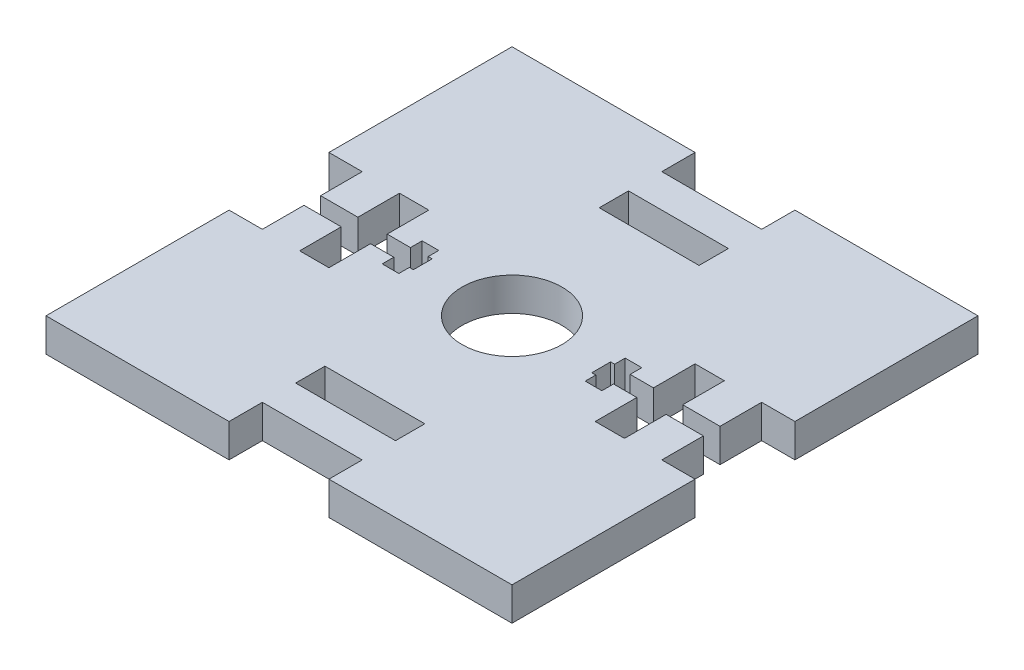
from build123d import *

# Parameters (mm, degrees)
SKETCH1_W           = 88.9
SKETCH1_H           = 88.9
BOSS_EXTRUDE1_DEPTH = 6.35
SKETCH2_R           = 9.525
SKETCH2_W           = 19.05
SKETCH2_H           = 5.588
SKETCH2_W_2         = 5.588
SKETCH2_H_2         = 19.05
CUT_EXTRUDE1_DEPTH  = 126.88384527
SKETCH3_W           = 19.05
SKETCH3_H           = 6.35
SKETCH3_W_2         = 6.35
SKETCH3_H_2         = 19.05
CUT_EXTRUDE2_DEPTH  = 126.88384527
CUT_EXTRUDE3_DEPTH  = 126.88384527


with BuildPart() as part:
    # Sketch1 → Boss-Extrude1 (new body)
    with BuildSketch(Plane(origin=(0, 0, 0), x_dir=(1, 0, 0), z_dir=(0, 1, 0))):
        with Locations((44.45, 44.45)):
            Rectangle(SKETCH1_W, SKETCH1_H)
    extrude(amount=BOSS_EXTRUDE1_DEPTH)

    # Sketch2 → Cut-Extrude1 (cut, through all)
    with BuildSketch(Plane(origin=(0, 6.35, 0), x_dir=(1, 0, 0), z_dir=(0, 1, 0))):
        with Locations(Location((44.45, 44.45, 0), (0, 0, 270))):
            Circle(SKETCH2_R)
        with Locations((44.45, 73.406)):
            Rectangle(SKETCH2_W, SKETCH2_H)
        with Locations((16.256, 44.45)):
            Rectangle(SKETCH2_W_2, SKETCH2_H_2)
        with Locations((72.644, 44.45)):
            Rectangle(SKETCH2_W_2, SKETCH2_H_2)
        with Locations((44.45, 15.494)):
            Rectangle(SKETCH2_W, SKETCH2_H)
    extrude(amount=-CUT_EXTRUDE1_DEPTH, mode=Mode.SUBTRACT)

    # Sketch3 → Cut-Extrude2 (cut, through all)
    with BuildSketch(Plane(origin=(0, 6.35, 0), x_dir=(1, 0, 0), z_dir=(0, 1, 0))):
        with Locations((44.45, 85.725)):
            Rectangle(SKETCH3_W, SKETCH3_H)
        with Locations((85.725, 44.45)):
            Rectangle(SKETCH3_W_2, SKETCH3_H_2)
        with Locations((44.45, 3.175)):
            Rectangle(SKETCH3_W, SKETCH3_H)
        with Locations((3.175, 44.45)):
            Rectangle(SKETCH3_W_2, SKETCH3_H_2)
    extrude(amount=-CUT_EXTRUDE2_DEPTH, mode=Mode.SUBTRACT)

    # Sketch4 → Cut-Extrude3 (cut, through all)
    with BuildSketch(Plane(origin=(0, 6.35, 0), x_dir=(1, 0, 0), z_dir=(0, 1, 0))):
        Polygon((23.495, 46.0375), (23.495, 48.26), (26.67, 48.26), (26.67, 46.249166667), (27.432, 46.249166667), (27.432, 42.650833333), (26.67, 42.650833333), (26.67, 40.64), (23.495, 40.64), (23.495, 42.8625), (6.35, 42.8625), (6.35, 46.0375), align=None)
        Polygon((62.23, 46.249166667), (61.468, 46.249166667), (61.468, 42.650833333), (62.23, 42.650833333), (62.23, 40.64), (65.405, 40.64), (65.405, 42.8625), (82.55, 42.8625), (82.55, 46.0375), (65.405, 46.0375), (65.405, 48.26), (62.23, 48.26), align=None)
    extrude(amount=-CUT_EXTRUDE3_DEPTH, mode=Mode.SUBTRACT)


solid = part.part
